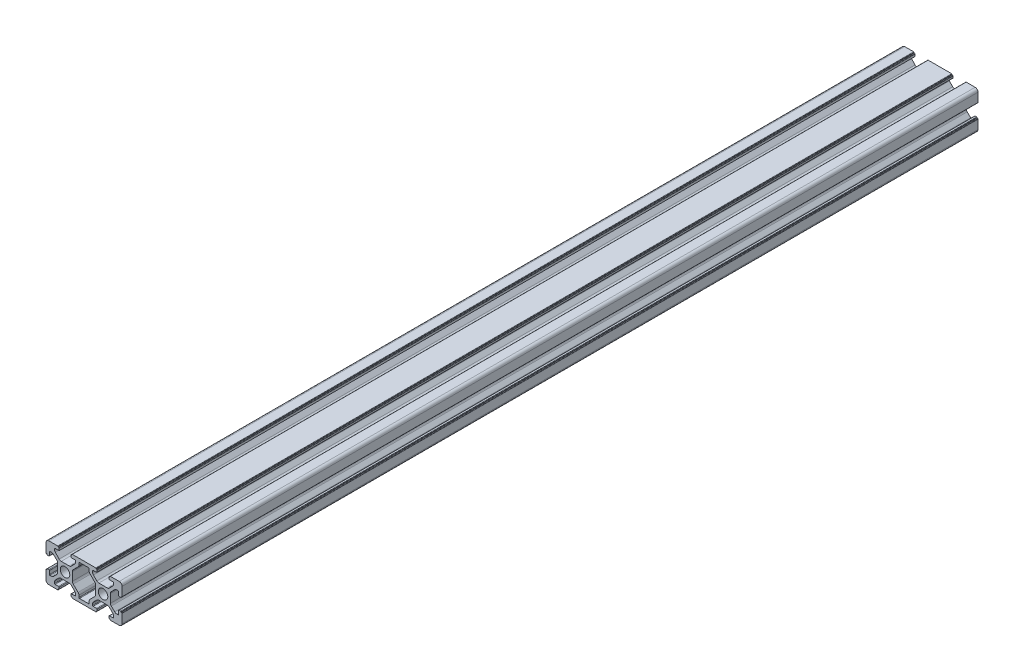
from build123d import *

# Parameters (mm, degrees)
SKETCH1_R           = 2.5
BOSS_EXTRUDE2_DEPTH = 450


with BuildPart() as part:
    # Sketch1 → Boss-Extrude2 (new body)
    with BuildSketch(Plane.XY):
        with BuildLine():
            Line((1.5, 0), (6.2, 0))
            ThreePointArc((6.2, 0), (6.341421356, 0.058578644), (6.4, 0.2))
            Line((6.4, 0.2), (6.4, 0.3))
            ThreePointArc((6.4, 0.3), (6.458578644, 0.441421356), (6.6, 0.5))
            Line((6.6, 0.5), (6.7, 0.5))
            ThreePointArc((6.7, 0.5), (6.841421356, 0.558578644), (6.9, 0.7))
            Line((6.9, 0.7), (6.9, 1.5))
            ThreePointArc((6.9, 1.5), (6.812132034, 1.712132034), (6.6, 1.8))
            Line((6.6, 1.8), (4.8, 1.8))
            ThreePointArc((4.8, 1.8), (4.587867966, 1.887867966), (4.5, 2.1))
            Line((4.5, 2.1), (4.5, 2.818019485))
            ThreePointArc((4.5, 2.818019485), (4.614180701, 3.392044633), (4.939339828, 3.878679656))
            Line((4.939339828, 3.878679656), (6.721320344, 5.660660172))
            ThreePointArc((6.721320344, 5.660660172), (7.207955367, 5.985819299), (7.781980515, 6.1))
            Line((7.781980515, 6.1), (12.218019485, 6.1))
            ThreePointArc((12.218019485, 6.1), (12.792044633, 5.985819299), (13.278679656, 5.660660172))
            Line((13.278679656, 5.660660172), (15.060660172, 3.878679656))
            ThreePointArc((15.060660172, 3.878679656), (15.385819299, 3.392044633), (15.5, 2.818019485))
            Line((15.5, 2.818019485), (15.5, 2.1))
            ThreePointArc((15.5, 2.1), (15.412132034, 1.887867966), (15.2, 1.8))
            Line((15.2, 1.8), (13.4, 1.8))
            ThreePointArc((13.4, 1.8), (13.187867966, 1.712132034), (13.1, 1.5))
            Line((13.1, 1.5), (13.1, 0.7))
            ThreePointArc((13.1, 0.7), (13.158578644, 0.558578644), (13.3, 0.5))
            Line((13.3, 0.5), (13.4, 0.5))
            ThreePointArc((13.4, 0.5), (13.541421356, 0.441421356), (13.6, 0.3))
            Line((13.6, 0.3), (13.6, 0.2))
            ThreePointArc((13.6, 0.2), (13.658578644, 0.058578644), (13.8, 0))
            Line((13.8, 0), (26.2, 0))
            ThreePointArc((26.2, 0), (26.341421356, 0.058578644), (26.4, 0.2))
            Line((26.4, 0.2), (26.4, 0.3))
            ThreePointArc((26.4, 0.3), (26.458578644, 0.441421356), (26.6, 0.5))
            Line((26.6, 0.5), (26.7, 0.5))
            ThreePointArc((26.7, 0.5), (26.841421356, 0.558578644), (26.9, 0.7))
            Line((26.9, 0.7), (26.9, 1.5))
            ThreePointArc((26.9, 1.5), (26.812132034, 1.712132034), (26.6, 1.8))
            Line((26.6, 1.8), (24.8, 1.8))
            ThreePointArc((24.8, 1.8), (24.587867966, 1.887867966), (24.5, 2.1))
            Line((24.5, 2.1), (24.5, 2.818019485))
            ThreePointArc((24.5, 2.818019485), (24.614180701, 3.392044633), (24.939339828, 3.878679656))
            Line((24.939339828, 3.878679656), (26.721320344, 5.660660172))
            ThreePointArc((26.721320344, 5.660660172), (27.207955367, 5.985819299), (27.781980515, 6.1))
            Line((27.781980515, 6.1), (32.218019485, 6.1))
            ThreePointArc((32.218019485, 6.1), (32.792044633, 5.985819299), (33.278679656, 5.660660172))
            Line((33.278679656, 5.660660172), (35.060660172, 3.878679656))
            ThreePointArc((35.060660172, 3.878679656), (35.385819299, 3.392044633), (35.5, 2.818019485))
            Line((35.5, 2.818019485), (35.5, 2.1))
            ThreePointArc((35.5, 2.1), (35.412132034, 1.887867966), (35.2, 1.8))
            Line((35.2, 1.8), (33.4, 1.8))
            ThreePointArc((33.4, 1.8), (33.187867966, 1.712132034), (33.1, 1.5))
            Line((33.1, 1.5), (33.1, 0.7))
            ThreePointArc((33.1, 0.7), (33.158578644, 0.558578644), (33.3, 0.5))
            Line((33.3, 0.5), (33.4, 0.5))
            ThreePointArc((33.4, 0.5), (33.541421356, 0.441421356), (33.6, 0.3))
            Line((33.6, 0.3), (33.6, 0.2))
            ThreePointArc((33.6, 0.2), (33.658578644, 0.058578644), (33.8, 0))
            Line((33.8, 0), (38.5, 0))
            ThreePointArc((38.5, 0), (39.560660172, 0.439339828), (40, 1.5))
            Line((40, 1.5), (40, 6.2))
            ThreePointArc((40, 6.2), (39.941421356, 6.341421356), (39.8, 6.4))
            Line((39.8, 6.4), (39.7, 6.4))
            ThreePointArc((39.7, 6.4), (39.558578644, 6.458578644), (39.5, 6.6))
            Line((39.5, 6.6), (39.5, 6.7))
            ThreePointArc((39.5, 6.7), (39.441421356, 6.841421356), (39.3, 6.9))
            Line((39.3, 6.9), (38.5, 6.9))
            ThreePointArc((38.5, 6.9), (38.287867966, 6.812132034), (38.2, 6.6))
            Line((38.2, 6.6), (38.2, 4.8))
            ThreePointArc((38.2, 4.8), (38.112132034, 4.587867966), (37.9, 4.5))
            Line((37.9, 4.5), (37.181980515, 4.5))
            ThreePointArc((37.181980515, 4.5), (36.607955367, 4.614180701), (36.121320344, 4.939339828))
            Line((36.121320344, 4.939339828), (34.339339828, 6.721320344))
            ThreePointArc((34.339339828, 6.721320344), (34.014180701, 7.207955367), (33.9, 7.781980515))
            Line((33.9, 7.781980515), (33.9, 12.218019485))
            ThreePointArc((33.9, 12.218019485), (34.014180701, 12.792044633), (34.339339828, 13.278679656))
            Line((34.339339828, 13.278679656), (36.121320344, 15.060660172))
            ThreePointArc((36.121320344, 15.060660172), (36.607955367, 15.385819299), (37.181980515, 15.5))
            Line((37.181980515, 15.5), (37.9, 15.5))
            ThreePointArc((37.9, 15.5), (38.112132034, 15.412132034), (38.2, 15.2))
            Line((38.2, 15.2), (38.2, 13.4))
            ThreePointArc((38.2, 13.4), (38.287867966, 13.187867966), (38.5, 13.1))
            Line((38.5, 13.1), (39.3, 13.1))
            ThreePointArc((39.3, 13.1), (39.441421356, 13.158578644), (39.5, 13.3))
            Line((39.5, 13.3), (39.5, 13.4))
            ThreePointArc((39.5, 13.4), (39.558578644, 13.541421356), (39.7, 13.6))
            Line((39.7, 13.6), (39.8, 13.6))
            ThreePointArc((39.8, 13.6), (39.941421356, 13.658578644), (40, 13.8))
            Line((40, 13.8), (40, 18.5))
            ThreePointArc((40, 18.5), (39.560660172, 19.560660172), (38.5, 20))
            Line((38.5, 20), (33.8, 20))
            ThreePointArc((33.8, 20), (33.658578644, 19.941421356), (33.6, 19.8))
            Line((33.6, 19.8), (33.6, 19.7))
            ThreePointArc((33.6, 19.7), (33.541421356, 19.558578644), (33.4, 19.5))
            Line((33.4, 19.5), (33.3, 19.5))
            ThreePointArc((33.3, 19.5), (33.158578644, 19.441421356), (33.1, 19.3))
            Line((33.1, 19.3), (33.1, 18.5))
            ThreePointArc((33.1, 18.5), (33.187867966, 18.287867966), (33.4, 18.2))
            Line((33.4, 18.2), (35.2, 18.2))
            ThreePointArc((35.2, 18.2), (35.412132034, 18.112132034), (35.5, 17.9))
            Line((35.5, 17.9), (35.5, 17.181980515))
            ThreePointArc((35.5, 17.181980515), (35.385819299, 16.607955367), (35.060660172, 16.121320344))
            Line((35.060660172, 16.121320344), (33.278679656, 14.339339828))
            ThreePointArc((33.278679656, 14.339339828), (32.792044633, 14.014180701), (32.218019485, 13.9))
            Line((32.218019485, 13.9), (27.781980515, 13.9))
            ThreePointArc((27.781980515, 13.9), (27.207955367, 14.014180701), (26.721320344, 14.339339828))
            Line((26.721320344, 14.339339828), (24.939339828, 16.121320344))
            ThreePointArc((24.939339828, 16.121320344), (24.614180701, 16.607955367), (24.5, 17.181980515))
            Line((24.5, 17.181980515), (24.5, 17.9))
            ThreePointArc((24.5, 17.9), (24.587867966, 18.112132034), (24.8, 18.2))
            Line((24.8, 18.2), (26.6, 18.2))
            ThreePointArc((26.6, 18.2), (26.812132034, 18.287867966), (26.9, 18.5))
            Line((26.9, 18.5), (26.9, 19.3))
            ThreePointArc((26.9, 19.3), (26.841421356, 19.441421356), (26.7, 19.5))
            Line((26.7, 19.5), (26.6, 19.5))
            ThreePointArc((26.6, 19.5), (26.458578644, 19.558578644), (26.4, 19.7))
            Line((26.4, 19.7), (26.4, 19.8))
            ThreePointArc((26.4, 19.8), (26.341421356, 19.941421356), (26.2, 20))
            Line((26.2, 20), (13.8, 20))
            ThreePointArc((13.8, 20), (13.658578644, 19.941421356), (13.6, 19.8))
            Line((13.6, 19.8), (13.6, 19.7))
            ThreePointArc((13.6, 19.7), (13.541421356, 19.558578644), (13.4, 19.5))
            Line((13.4, 19.5), (13.3, 19.5))
            ThreePointArc((13.3, 19.5), (13.158578644, 19.441421356), (13.1, 19.3))
            Line((13.1, 19.3), (13.1, 18.2))
            Line((13.1, 18.2), (15.3, 18.2))
            ThreePointArc((15.3, 18.2), (15.512132034, 18.112132034), (15.6, 17.9))
            Line((15.6, 17.9), (15.6, 17.281980515))
            ThreePointArc((15.6, 17.281980515), (15.485819299, 16.707955367), (15.160660172, 16.221320344))
            Line((15.160660172, 16.221320344), (13.278679656, 14.339339828))
            ThreePointArc((13.278679656, 14.339339828), (12.792044633, 14.014180701), (12.218019485, 13.9))
            Line((12.218019485, 13.9), (7.986375635, 13.9))
            ThreePointArc((7.986375635, 13.9), (7.393381044, 14.022191082), (6.896997987, 14.36885678))
            Line((6.896997987, 14.36885678), (4.910622352, 16.467414163))
            ThreePointArc((4.910622352, 16.467414163), (4.606431474, 16.943609851), (4.5, 17.498557383))
            Line((4.5, 17.498557383), (4.5, 17.9))
            ThreePointArc((4.5, 17.9), (4.587867966, 18.112132034), (4.8, 18.2))
            Line((4.8, 18.2), (6.9, 18.2))
            Line((6.9, 18.2), (6.9, 19.3))
            ThreePointArc((6.9, 19.3), (6.841421356, 19.441421356), (6.7, 19.5))
            Line((6.7, 19.5), (6.6, 19.5))
            ThreePointArc((6.6, 19.5), (6.458578644, 19.558578644), (6.4, 19.7))
            Line((6.4, 19.7), (6.4, 19.8))
            ThreePointArc((6.4, 19.8), (6.341421356, 19.941421356), (6.2, 20))
            Line((6.2, 20), (1.5, 20))
            ThreePointArc((1.5, 20), (0.439339828, 19.560660172), (0, 18.5))
            Line((0, 18.5), (0, 13.8))
            ThreePointArc((0, 13.8), (0.058578644, 13.658578644), (0.2, 13.6))
            Line((0.2, 13.6), (0.3, 13.6))
            ThreePointArc((0.3, 13.6), (0.441421356, 13.541421356), (0.5, 13.4))
            Line((0.5, 13.4), (0.5, 13.3))
            ThreePointArc((0.5, 13.3), (0.558578644, 13.158578644), (0.7, 13.1))
            Line((0.7, 13.1), (1.5, 13.1))
            ThreePointArc((1.5, 13.1), (1.712132034, 13.187867966), (1.8, 13.4))
            Line((1.8, 13.4), (1.8, 15.2))
            ThreePointArc((1.8, 15.2), (1.887867966, 15.412132034), (2.1, 15.5))
            Line((2.1, 15.5), (2.818019485, 15.5))
            ThreePointArc((2.818019485, 15.5), (3.392044633, 15.385819299), (3.878679656, 15.060660172))
            Line((3.878679656, 15.060660172), (5.660660172, 13.278679656))
            ThreePointArc((5.660660172, 13.278679656), (5.985819299, 12.792044633), (6.1, 12.218019485))
            Line((6.1, 12.218019485), (6.1, 7.781980515))
            ThreePointArc((6.1, 7.781980515), (5.985819299, 7.207955367), (5.660660172, 6.721320344))
            Line((5.660660172, 6.721320344), (3.878679656, 4.939339828))
            ThreePointArc((3.878679656, 4.939339828), (3.392044633, 4.614180701), (2.818019485, 4.5))
            Line((2.818019485, 4.5), (2.1, 4.5))
            ThreePointArc((2.1, 4.5), (1.887867966, 4.587867966), (1.8, 4.8))
            Line((1.8, 4.8), (1.8, 6.6))
            ThreePointArc((1.8, 6.6), (1.712132034, 6.812132034), (1.5, 6.9))
            Line((1.5, 6.9), (0.7, 6.9))
            ThreePointArc((0.7, 6.9), (0.558578644, 6.841421356), (0.5, 6.7))
            Line((0.5, 6.7), (0.5, 6.6))
            ThreePointArc((0.5, 6.6), (0.441421356, 6.458578644), (0.3, 6.4))
            Line((0.3, 6.4), (0.2, 6.4))
            ThreePointArc((0.2, 6.4), (0.058578644, 6.341421356), (0, 6.2))
            Line((0, 6.2), (0, 1.5))
            ThreePointArc((0, 1.5), (0.439339828, 0.439339828), (1.5, 0))
        make_face()
        with Locations((10, 10)):
            Circle(SKETCH1_R, mode=Mode.SUBTRACT)
        with Locations((30, 10)):
            Circle(SKETCH1_R, mode=Mode.SUBTRACT)
        with BuildLine():
            Line((17.6, 1.8), (22.4, 1.8))
            ThreePointArc((22.4, 1.8), (22.612132034, 1.887867966), (22.7, 2.1))
            Line((22.7, 2.1), (22.7, 3.139339828))
            ThreePointArc((22.7, 3.139339828), (22.814180701, 3.713364977), (23.139339828, 4.2))
            Line((23.139339828, 4.2), (25.660660172, 6.721320344))
            ThreePointArc((25.660660172, 6.721320344), (25.985819299, 7.207955367), (26.1, 7.781980515))
            Line((26.1, 7.781980515), (26.1, 12.218019485))
            ThreePointArc((26.1, 12.218019485), (25.985819299, 12.792044633), (25.660660172, 13.278679656))
            Line((25.660660172, 13.278679656), (23.139339828, 15.8))
            ThreePointArc((23.139339828, 15.8), (22.814180701, 16.286635023), (22.7, 16.860660172))
            Line((22.7, 16.860660172), (22.7, 17.9))
            ThreePointArc((22.7, 17.9), (22.612132034, 18.112132034), (22.4, 18.2))
            Line((22.4, 18.2), (17.6, 18.2))
            ThreePointArc((17.6, 18.2), (17.387867966, 18.112132034), (17.3, 17.9))
            Line((17.3, 17.9), (17.3, 16.860660172))
            ThreePointArc((17.3, 16.860660172), (17.185819299, 16.286635023), (16.860660172, 15.8))
            Line((16.860660172, 15.8), (14.339339828, 13.278679656))
            ThreePointArc((14.339339828, 13.278679656), (14.014180701, 12.792044633), (13.9, 12.218019485))
            Line((13.9, 12.218019485), (13.9, 7.781980515))
            ThreePointArc((13.9, 7.781980515), (14.014180701, 7.207955367), (14.339339828, 6.721320344))
            Line((14.339339828, 6.721320344), (16.860660172, 4.2))
            ThreePointArc((16.860660172, 4.2), (17.185819299, 3.713364977), (17.3, 3.139339828))
            Line((17.3, 3.139339828), (17.3, 2.1))
            ThreePointArc((17.3, 2.1), (17.387867966, 1.887867966), (17.6, 1.8))
        make_face(mode=Mode.SUBTRACT)
    extrude(amount=BOSS_EXTRUDE2_DEPTH)


solid = part.part
